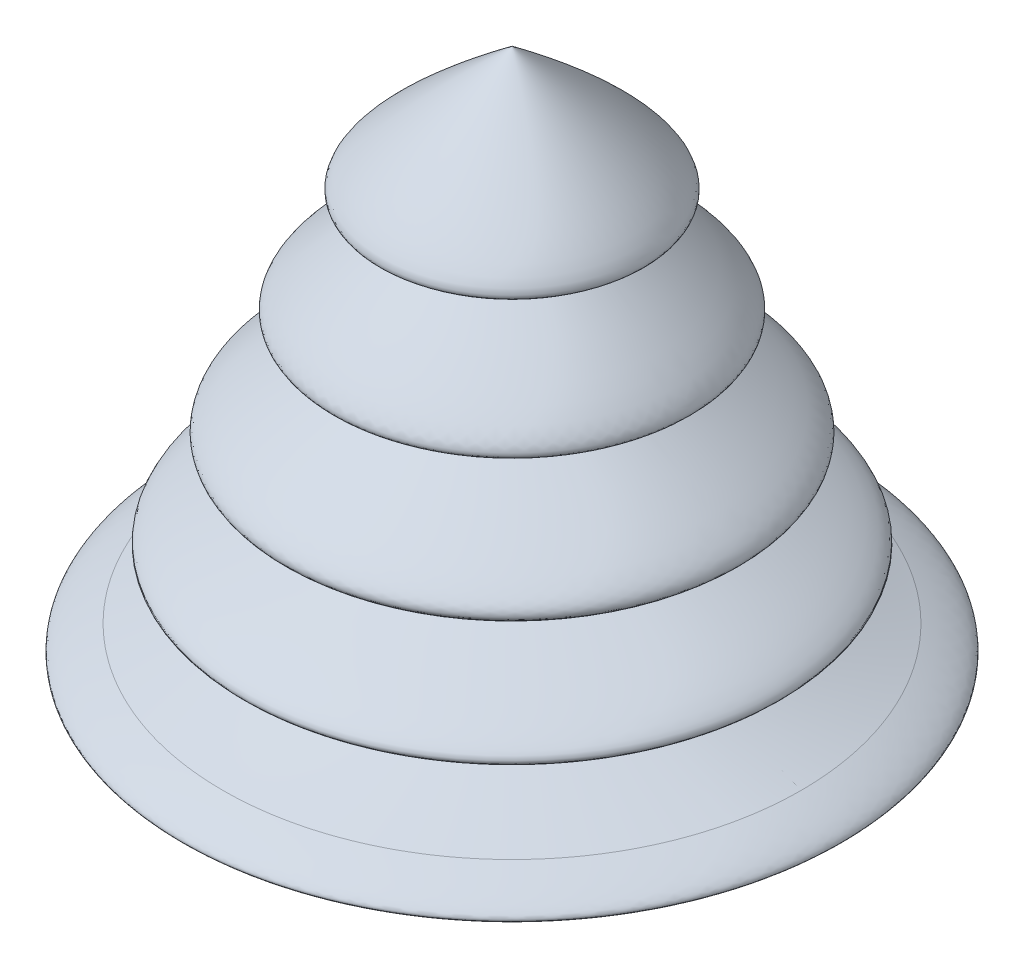
from build123d import *

# Parameters (mm, degrees)
SZKIC2_R                    = 13
DODANIE_WYCI_GNI_CIE1_DEPTH = 10
DODANIE_WYCI_GNI_CIE1_DRAFT = -30


with BuildPart() as part:
    # Szkic1 → Obrót1 (revolve)
    with BuildSketch(Plane.XY):
        with BuildLine():
            Line((0, -7.637730708), (0, 79.994598037))
            add(Edge.make_bspline(
                [(0, 79.994598037), (45.783693378, 44.041229204), (-16.652057424, 77.499869124), (43.321818222, 35.918021719), (-1.176058128, 47.416123495), (56.214226675, 19.282948895), (6.475323145, 25.538730645), (29.651662376, 17.326976042), (53.826421235, 6.031060214), (18.77217049, 8.336972737), (47.936689773, -2.903870531), (47.93669181, -2.903870842)],
                knots=[0, 0, 0, 0, 0.18533447, 0.281542437, 0.35605092, 0.476894293, 0.611778523, 0.765990994, 0.898027808, 0.921428709, 1, 1, 1, 1], degree=3))
            add(Edge.make_bspline(
                [(47.93669181, -2.903870842), (54.424452566, -5.6073964), (56.202071439, -7.185349783), (53.269547864, -7.637730708)],
                knots=[0, 0, 0, 0, 0.7133116, 0.7133116, 0.7133116, 0.7133116], degree=3))
            Line((53.269547864, -7.637730708), (0, -7.637730708))
        make_face()
    revolve(axis=Axis((0, -7.637730708, 0), (0, 1, 0)))


with BuildPart() as dodanie_wyci_gni_cie1_tool:
    # Szkic2 → Dodanie-wyciągnięcie1 (with draft: the straight prism first)
    with BuildSketch(Plane.XZ.offset(7.637730708)):
        Circle(SZKIC2_R)
    extrude(amount=DODANIE_WYCI_GNI_CIE1_DEPTH)
    # Dodanie-wyciągnięcie1: the draft: its side faces are tilted about the plane it starts from
    dodanie_wyci_gni_cie1_sides = [dodanie_wyci_gni_cie1_tool.faces().sort_by_distance(p)[0] for p in [
        (-13, -12.637730708, 0),
    ]]
    draft(dodanie_wyci_gni_cie1_sides, Plane.XZ.offset(7.637730708), DODANIE_WYCI_GNI_CIE1_DRAFT)


with BuildPart() as part_1:
    add(part.part)

    # Dodanie-wyciągnięcie1: add dodanie_wyci_gni_cie1_tool
    add(dodanie_wyci_gni_cie1_tool.part)


solid = part_1.part
